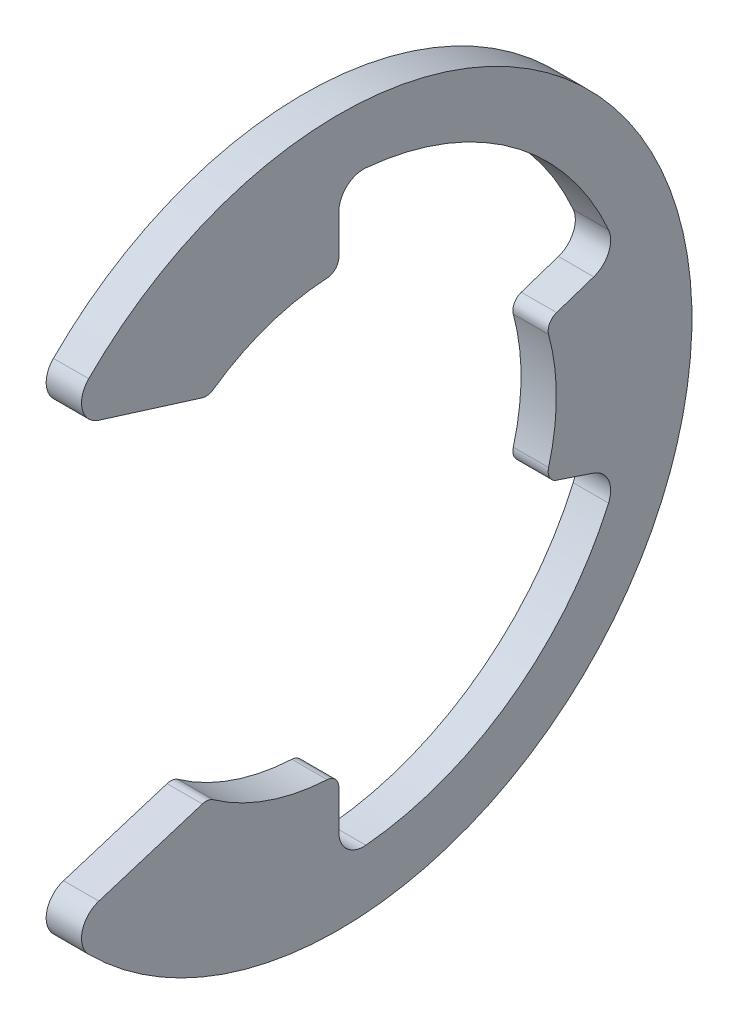
from build123d import *

# Parameters (mm, degrees)
BOSS_EXTRUDE1_DEPTH      = 0.635
BOSS_EXTRUDE1_DEPTH_BACK = 0.635
FILLET1_R                = 0.889
FILLET2_R                = 0.4445


with BuildPart() as part:
    # Sketch3 → Boss-Extrude1 (new, two sides: drawn at the far end of the back side and taken through both)
    with BuildSketch(Plane(origin=(0, 0, 0), x_dir=(0, 0, -1), z_dir=(1, 0, 0)).offset(-BOSS_EXTRUDE1_DEPTH_BACK)):
        with BuildLine():
            Line((7.421739177, -2.473913059), (10.049041065, -3.349680355))
            ThreePointArc((10.049041065, -3.349680355), (6.193613478, -8.593179672), (0, -10.592619355))
            Line((0, -10.592619355), (0, -7.8232))
            ThreePointArc((0, -7.8232), (-2.473913059, -7.421739177), (-4.69392, -6.25856))
            Line((-4.69392, -6.25856), (-9.944789181, -7.898808021))
            ThreePointArc((-9.944789181, -7.898808021), (12.7, 0), (-9.944789181, 7.898808021))
            Line((-9.944789181, 7.898808021), (-4.69392, 6.25856))
            ThreePointArc((-4.69392, 6.25856), (-2.473913059, 7.421739177), (0, 7.8232))
            Line((0, 7.8232), (0, 10.592619355))
            ThreePointArc((0, 10.592619355), (6.193613478, 8.593179672), (10.049041065, 3.349680355))
            Line((10.049041065, 3.349680355), (7.421739177, 2.473913059))
            ThreePointArc((7.421739177, 2.473913059), (7.8232, 0), (7.421739177, -2.473913059))
        make_face()
    extrude(amount=BOSS_EXTRUDE1_DEPTH + BOSS_EXTRUDE1_DEPTH_BACK)

    # Fillet1
    fillet1_edges = [part.edges().sort_by_distance(p)[0] for p in [
        (0, 3.349680355, -10.049041065),
        (0, 10.592619355, 0),
        (0, 7.898808021, 9.944789181),
        (0, -7.898808021, 9.944789181),
        (0, -10.592619355, 0),
        (0, -3.349680355, -10.049041065),
    ]]
    fillet(fillet1_edges, radius=FILLET1_R)

    # Fillet2
    fillet2_edges = [part.edges().sort_by_distance(p)[0] for p in [
        (0, 2.473913059, -7.421739177),
        (0, 7.8232, 0),
        (0, 6.25856, 4.69392),
        (0, -6.25856, 4.69392),
        (0, -7.8232, 0),
        (0, -2.473913059, -7.421739177),
    ]]
    fillet(fillet2_edges, radius=FILLET2_R)


solid = part.part
